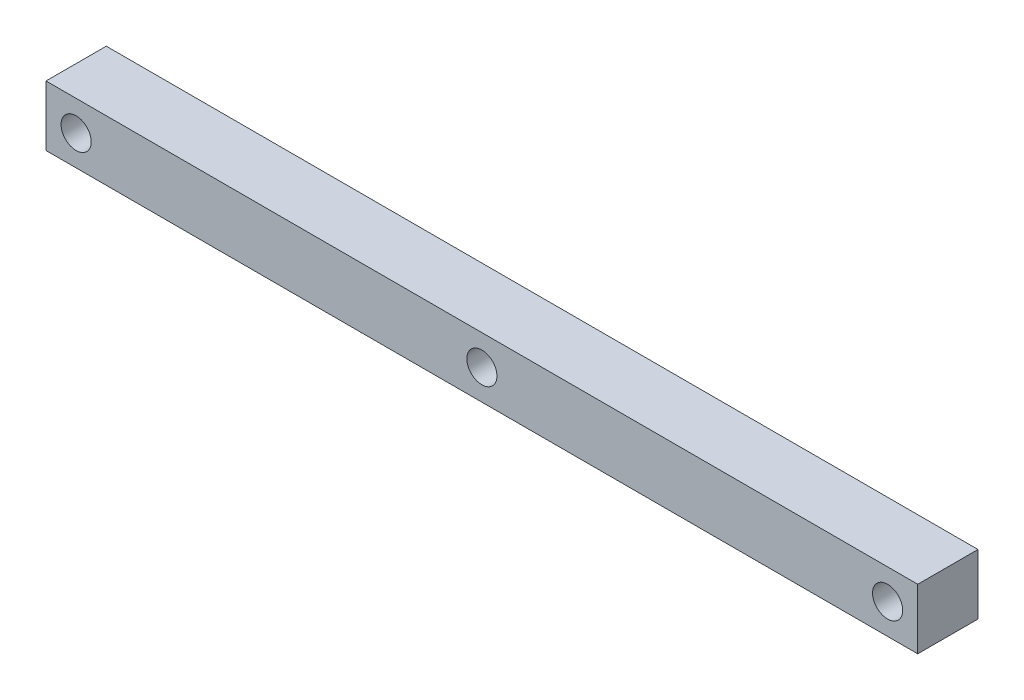
from build123d import *

# Parameters (mm, degrees)
SKETCH1_W           = 434
SKETCH1_H           = 30
SKETCH1_R           = 7.5
BOSS_EXTRUDE1_DEPTH = 15


with BuildPart() as part:
    # Sketch1 → Boss-Extrude1 (new, symmetric)
    with BuildSketch(Plane.XY):
        Rectangle(SKETCH1_W, SKETCH1_H)
        with Locations((-202, 0)):
            Circle(SKETCH1_R, mode=Mode.SUBTRACT)
        with Locations((202, 0)):
            Circle(SKETCH1_R, mode=Mode.SUBTRACT)
        Circle(SKETCH1_R, mode=Mode.SUBTRACT)
    extrude(amount=BOSS_EXTRUDE1_DEPTH, both=True)


solid = part.part
